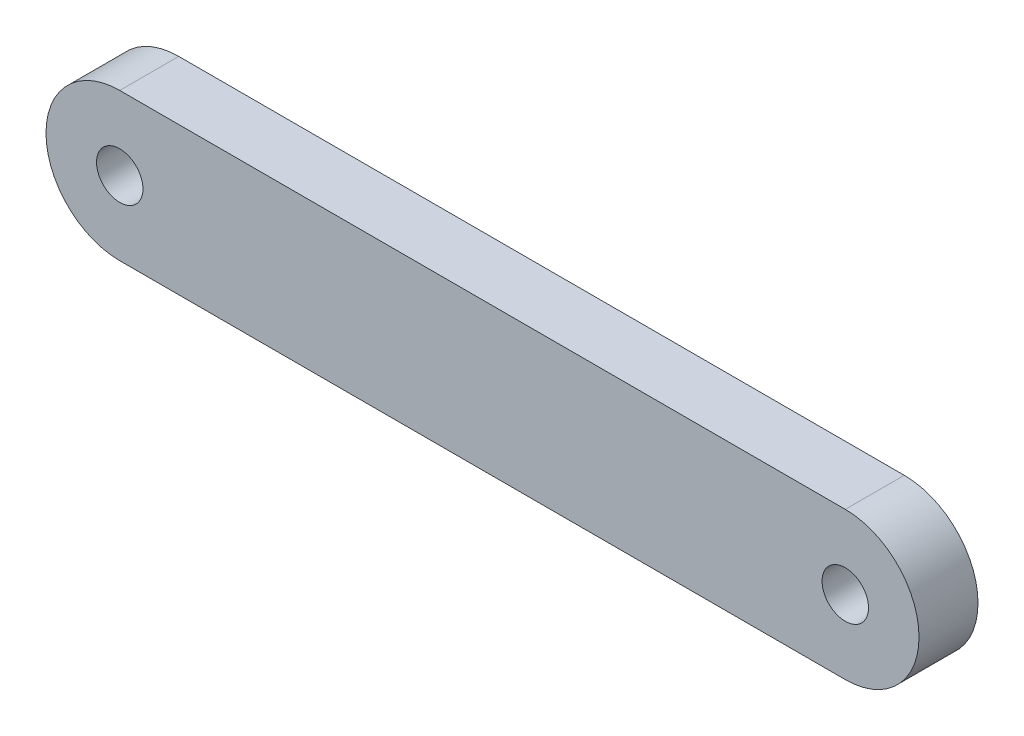
from build123d import *

# Parameters (mm, degrees)
SKETCH1_R           = 2
BOSS_EXTRUDE1_DEPTH = 5.08


with BuildPart() as part:
    # Sketch1 → Boss-Extrude1 (new body)
    with BuildSketch(Plane.XY):
        with BuildLine():
            Line((0, 6.35), (62.484, 6.35))
            ThreePointArc((62.484, 6.35), (68.834, 0), (62.484, -6.35))
            Line((62.484, -6.35), (0, -6.35))
            ThreePointArc((0, -6.35), (-6.35, 0), (0, 6.35))
        make_face()
        Circle(SKETCH1_R, mode=Mode.SUBTRACT)
        with Locations((62.484, 0)):
            Circle(SKETCH1_R, mode=Mode.SUBTRACT)
    extrude(amount=BOSS_EXTRUDE1_DEPTH)


solid = part.part
